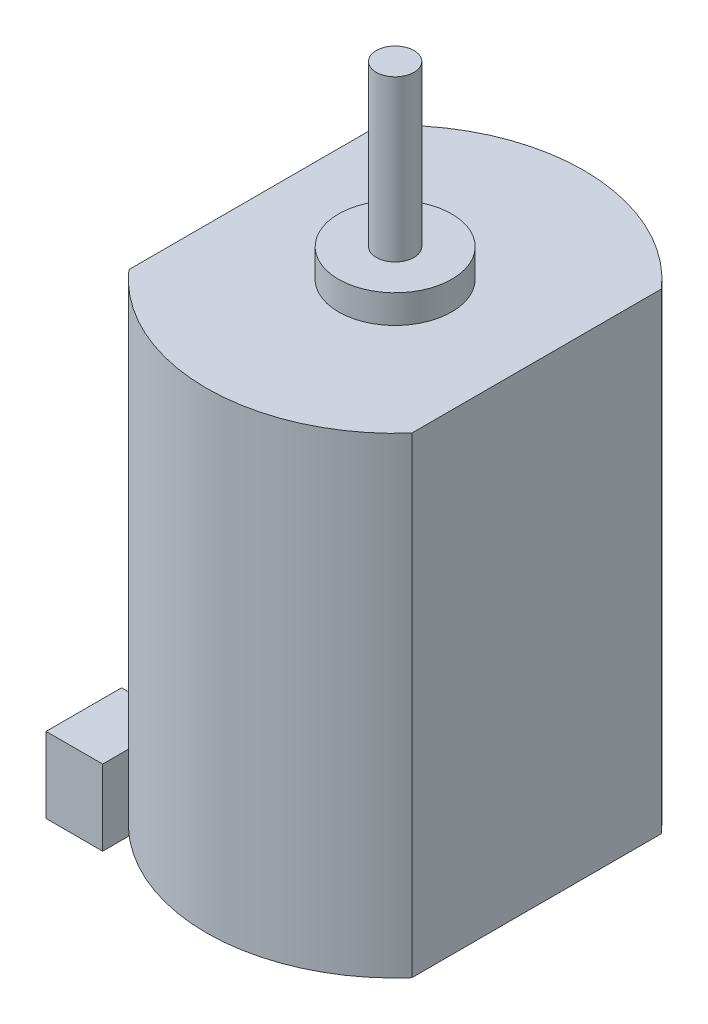
from build123d import *

# Parameters (mm, degrees)
SKETCH_1_R            = 10
EXTRUDE_1_DEPTH       = 25
CUT_EXTRUDE_2_1_REACH = 30.723
SKETCH_2_W            = 2.5
SKETCH_2_H            = 20
SKETCH_3_R            = 3
EXTRUDE_2_DEPTH       = 1.5
EXTRUDE_START         = -1.5
SKETCH_4_R            = 1
EXTRUDE_3_DEPTH       = 10
EXTRUDE_START_2       = -25
EXTRUDE_4_DEPTH       = 27.3
EXTRUDE_START_3       = 1
SKETCH_6_R            = 1
EXTRUDE_5_DEPTH       = 1
SKETCH_7_W            = 4
SKETCH_7_H            = 4
EXTRUDE_6_DEPTH       = 3


with BuildPart() as part:
    # 草图1 → 圆柱凸台-拉伸1 (new body)
    with BuildSketch(Plane(origin=(0, 0, 0), x_dir=(1, 0, 0), z_dir=(0, 1, 0))):
        with Locations(Location((0, 0, 0), (0, 0, 270))):
            Circle(SKETCH_1_R)
    extrude(amount=EXTRUDE_1_DEPTH)

    # 草图2 → 2边切除切除-拉伸1 (cut, up to next)
    with BuildSketch(Plane.XZ, mode=Mode.PRIVATE) as cut_extrude_2_1_sk1:
        with Locations((-8.75, 0)):
            Rectangle(SKETCH_2_W, SKETCH_2_H)
    cut_extrude_2_1_tool1 = extrude(cut_extrude_2_1_sk1.sketch, amount=-CUT_EXTRUDE_2_1_REACH, mode=Mode.PRIVATE) & part.part
    # 草图2 → 2边切除切除-拉伸1 (cut, up to next)
    with BuildSketch(Plane.XZ, mode=Mode.PRIVATE) as cut_extrude_2_1_sk2:
        with Locations((8.75, 0)):
            Rectangle(SKETCH_2_W, SKETCH_2_H)
    cut_extrude_2_1_tool2 = extrude(cut_extrude_2_1_sk2.sketch, amount=-CUT_EXTRUDE_2_1_REACH, mode=Mode.PRIVATE) & part.part
    add(cut_extrude_2_1_tool1.solids().sort_by_distance((-8.75, 0, 0))[0], mode=Mode.SUBTRACT)
    add(cut_extrude_2_1_tool2.solids().sort_by_distance((8.75, 0, 0))[0], mode=Mode.SUBTRACT)

    # 草图3 → 前转凸台-拉伸2 (add)
    with BuildSketch(Plane(origin=(0, 25, 0), x_dir=(1, 0, 0), z_dir=(0, 1, 0))):
        with Locations(Location((0, 0, 0), (0, 0, 270))):
            Circle(SKETCH_3_R)
    extrude(amount=EXTRUDE_2_DEPTH)

    # 草图4 → 前转杆凸台-拉伸3 (add)
    with BuildSketch(Plane(origin=(0, 26.5, 0), x_dir=(1, 0, 0), z_dir=(0, 1, 0)).offset(EXTRUDE_START)):
        with Locations(Location((0, 0, 0), (0, 0, 270))):
            Circle(SKETCH_4_R)
    extrude(amount=EXTRUDE_3_DEPTH)

    # 草图5 → 后转凸台-拉伸4 (add)
    with BuildSketch(Plane.XZ.offset(EXTRUDE_START_2)):
        with BuildLine():
            Line((4, 3), (4, -3))
            ThreePointArc((4, -3), (-5, 0), (4, 3))
        make_face()
    extrude(amount=EXTRUDE_4_DEPTH)

    # 草图6 → 后转杆凸台-拉伸5 (add)
    with BuildSketch(Plane.XZ.offset(2.3).offset(EXTRUDE_START_3)):
        with Locations(Location((0, 0, 0), (0, 0, 90))):
            Circle(SKETCH_6_R)
    extrude(amount=-EXTRUDE_5_DEPTH)

    # 草图7 → 引线凸台-拉伸6 (add)
    with BuildSketch(Plane.ZY.offset(7.5)):
        with Locations((-6, 1)):
            Rectangle(SKETCH_7_W, SKETCH_7_H)
        with Locations((6, 1)):
            Rectangle(SKETCH_7_W, SKETCH_7_H)
    extrude(amount=EXTRUDE_6_DEPTH)


solid = part.part
